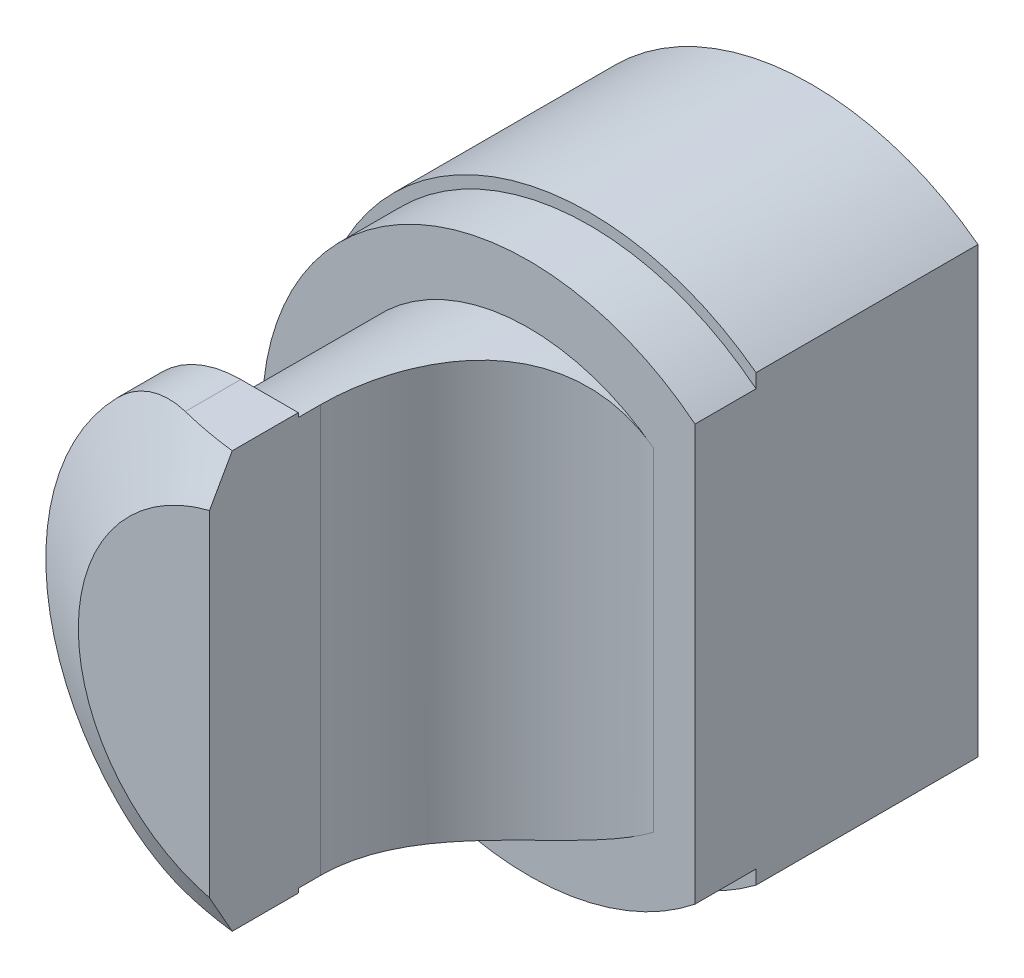
from build123d import *
from OCP.BRepFilletAPI import BRepFilletAPI_MakeChamfer

# Parameters (mm, degrees)
SKETCH1_R               = 2.4
BOSS_EXTRUDE1_DEPTH     = 0.55
SKETCH2_R               = 1.875
BOSS_EXTRUDE2_DEPTH     = 1.7
SKETCH3_R               = 2.5
BOSS_EXTRUDE3_DEPTH     = 2
SKETCH4_R               = 2.25
BOSS_EXTRUDE4_DEPTH     = 0.8
CUT_EXTRUDE1_REACH      = 8.165
SKETCH5_W               = 0.75
SKETCH5_H               = 6.07376998
CHAMFER1_SIZE           = 0.4
CHAMFER1_SIZE2          = 0.692820323
SKETCH6_W               = 6.999273813
SKETCH6_H               = 5.334981493
SKETCH6_W_2             = 6.558585844
SKETCH6_H_2             = 3.75
CUT_EXTRUDE3_DEPTH      = 2
FILLET2_R               = 1
SKETCH7_R               = 1
CUT_EXTRUDE4_DEPTH      = 2
CUT_EXTRUDE5_DEPTH      = 3
CUT_EXTRUDE5_DEPTH_BACK = 10
SKETCH9_W               = 3.309409713
SKETCH9_H               = 2.920914296
FILLET3_R               = 1.5
SKETCH10_W              = 2.950077704
SKETCH10_H              = 6.497759574
CUT_EXTRUDE6_DEPTH      = 10


with BuildPart() as part:
    # Sketch1 → Boss-Extrude1 (new body)
    with BuildSketch(Plane.XY):
        Circle(SKETCH1_R)
    extrude(amount=BOSS_EXTRUDE1_DEPTH)

    # Sketch2 → Boss-Extrude2 (add)
    with BuildSketch(Plane.XY.offset(0.55)):
        Circle(SKETCH2_R)
    extrude(amount=BOSS_EXTRUDE2_DEPTH)

    # Sketch3 → Boss-Extrude3 (add)
    with BuildSketch(Plane(origin=(0, 0, 0), x_dir=(-1, 0, 0), z_dir=(0, 0, -1))):
        Circle(SKETCH3_R)
    extrude(amount=BOSS_EXTRUDE3_DEPTH)

    # Sketch4 → Boss-Extrude4 (add)
    with BuildSketch(Plane.XY.offset(2.25)):
        Circle(SKETCH4_R)
    extrude(amount=BOSS_EXTRUDE4_DEPTH)

    # Cut-Extrude1: up to this face of the body (flat: up to its plane)
    cut_extrude1_end = Plane(part.part.faces().sort_by_distance((-2.332117749, 0, 0.55))[0])
    # Sketch5 → Cut-Extrude1 (cut, up to the picked face)
    with BuildSketch(Plane.XY.offset(3.05), mode=Mode.PRIVATE) as cut_extrude1_sk1:
        Rectangle(SKETCH5_W, SKETCH5_H)
    cut_extrude1_tool1 = split(extrude(cut_extrude1_sk1.sketch, amount=-CUT_EXTRUDE1_REACH, mode=Mode.PRIVATE), bisect_by=cut_extrude1_end, keep=Keep.BOTH, mode=Mode.PRIVATE)
    add(cut_extrude1_tool1.solids().sort_by(Axis((0, 0, 3.05), (0, 0, -1)))[0], mode=Mode.SUBTRACT)

    # Chamfer1: one chamfer whose edges measure the first distance from different faces: ONE call of the kernel's chamfer builder (chamfer() names one face for all edges)
    chamfer1_edges_1 = [part.edges().sort_by_distance(p)[0] for p in [
        (-2.25, 0, 3.05),
    ]]
    chamfer1_side_1 = [part.faces().sort_by_distance(p)[0] for p in [
        (-2.25, 0, 2.65),
    ]]
    chamfer1_edges_2 = [part.edges().sort_by_distance(p)[0] for p in [
        (2.25, 0, 3.05),
    ]]
    chamfer1_side_2 = [part.faces().sort_by_distance(p)[0] for p in [
        (2.25, 0, 2.65),
    ]]
    chamfer1 = BRepFilletAPI_MakeChamfer(part.part.solid().wrapped)
    for e in chamfer1_edges_1:
        chamfer1.Add(CHAMFER1_SIZE, CHAMFER1_SIZE2, e.wrapped, chamfer1_side_1[0].wrapped)  # the first distance lies on this face
    for e in chamfer1_edges_2:
        chamfer1.Add(CHAMFER1_SIZE, CHAMFER1_SIZE2, e.wrapped, chamfer1_side_2[0].wrapped)  # the first distance lies on this face
    add(Compound.cast(chamfer1.Shape()), mode=Mode.REPLACE)

    # Sketch6 → Cut-Extrude3 (cut)
    with BuildSketch(Plane.XY.offset(3.05)):
        with Locations((0.047792, -0.043471688)):
            Rectangle(SKETCH6_W, SKETCH6_H)
        Rectangle(SKETCH6_W_2, SKETCH6_H_2, mode=Mode.SUBTRACT)
    extrude(amount=-CUT_EXTRUDE3_DEPTH, mode=Mode.SUBTRACT)

    # Fillet2
    fillet2_edges = [part.edges().sort_by_distance(p)[0] for p in [
        (-1.243734296, 1.875, 2.45),
        (1.243734296, 1.875, 2.45),
        (-1.243734296, -1.875, 2.45),
        (1.243734296, -1.875, 2.45),
    ]]
    fillet(fillet2_edges, radius=FILLET2_R)

    # Sketch7 → Cut-Extrude4 (cut)
    with BuildSketch(Plane(origin=(0, 0, -2), x_dir=(-1, 0, 0), z_dir=(0, 0, -1))):
        Circle(SKETCH7_R)
    extrude(amount=-CUT_EXTRUDE4_DEPTH, mode=Mode.SUBTRACT)

    # Sketch9 → Cut-Extrude5 (cut, two sides: drawn at the far end of the back side and taken through both)
    with BuildSketch(Plane(origin=(0, 0, 0), x_dir=(1, 0, 0), z_dir=(0, 1, 0)).offset(-CUT_EXTRUDE5_DEPTH_BACK)):
        with Locations((1.654704857, -2.010457148)):
            Rectangle(SKETCH9_W, SKETCH9_H)
    extrude(amount=CUT_EXTRUDE5_DEPTH + CUT_EXTRUDE5_DEPTH_BACK, mode=Mode.SUBTRACT)

    # Fillet3
    fillet3_edges = [part.edges().sort_by_distance(p)[0] for p in [
        (-0.375, 0, 0.55),
    ]]
    fillet(fillet3_edges, radius=FILLET3_R)

    # Sketch10 → Cut-Extrude6 (cut)
    with BuildSketch(Plane.XY.offset(0.55)):
        with Locations((2.975038852, 0.087286089)):
            Rectangle(SKETCH10_W, SKETCH10_H)
    extrude(amount=-CUT_EXTRUDE6_DEPTH, mode=Mode.SUBTRACT)


solid = part.part
